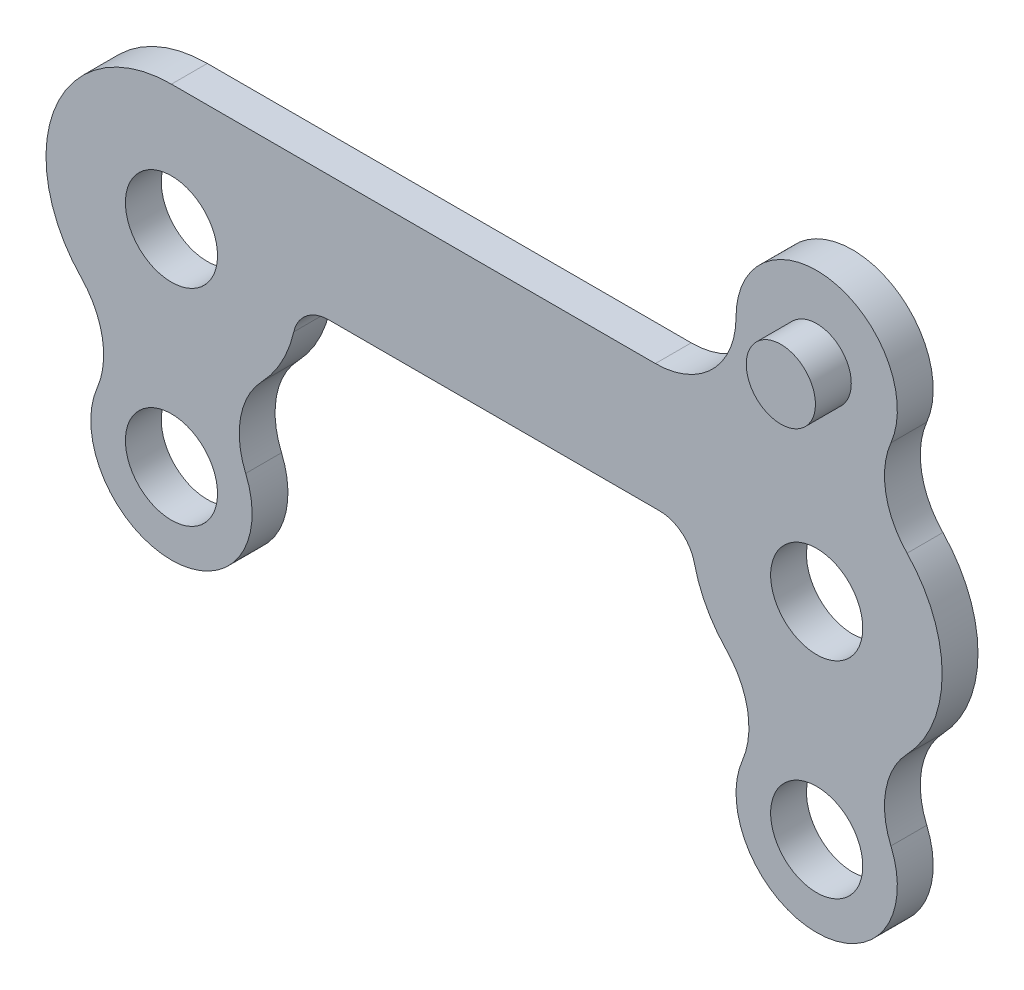
from build123d import *

# Parameters (mm, degrees)
SKETCH2_R           = 2.0399375
SKETCH2_R_2         = 1.5319375
BOSS_EXTRUDE1_DEPTH = 1.5875
SKETCH2_4_R         = 1.5319375
BOSS_EXTRUDE3_DEPTH = 3.175
FILLET1_R           = 1.5875


with BuildPart() as part:
    # Sketch2 → Boss-Extrude1 (new body)
    with BuildSketch(Plane.XY):
        with BuildLine():
            Line((21.43125, 5.55625), (0, 5.55625))
            ThreePointArc((0, 5.55625), (-5.113202022, 2.174184709), (-4.001636229, -3.854714199))
            ThreePointArc((-4.001636229, -3.854714199), (-3.061446645, -5.685103398), (-3.287058415, -7.730434766))
            ThreePointArc((-3.287058415, -7.730434766), (0, -12.7), (3.287058415, -7.730434766))
            ThreePointArc((3.287058415, -7.730434766), (3.061446641, -5.685103418), (4.0016362, -3.854714229))
            ThreePointArc((4.0016362, -3.854714229), (5.152960566, -2.078199091), (5.55625, 0))
            Line((5.55625, 0), (23.01875, 0))
            ThreePointArc((23.01875, 0), (23.422039385, -2.07819897), (24.573363619, -3.854714041))
            ThreePointArc((24.573363619, -3.854714041), (25.513553344, -5.685103337), (25.287941547, -7.730434854))
            ThreePointArc((25.287941547, -7.730434854), (28.575000048, -12.7), (31.862058415, -7.730434766))
            ThreePointArc((31.862058415, -7.730434766), (31.636446655, -5.685103342), (32.576636308, -3.854714117))
            ThreePointArc((32.576636308, -3.854714117), (34.13125, -7.3e-08), (32.576636409, 3.854714012))
            ThreePointArc((32.576636409, 3.854714012), (31.636446674, 5.685103241), (31.862058392, 7.730434711))
            ThreePointArc((31.862058392, 7.730434711), (29.288207306, 12.628071622), (25.003125, 9.128125))
            ThreePointArc((25.003125, 9.128125), (23.956947034, 6.602427966), (21.43125, 5.55625))
        make_face()
        Circle(SKETCH2_R, mode=Mode.SUBTRACT)
        with Locations((28.575, 0)):
            Circle(SKETCH2_R, mode=Mode.SUBTRACT)
        with Locations((28.575, 9.128125)):
            Circle(SKETCH2_R_2, mode=Mode.SUBTRACT)
        with Locations((0, -9.128125)):
            Circle(SKETCH2_R, mode=Mode.SUBTRACT)
        with Locations((28.575, -9.128125)):
            Circle(SKETCH2_R, mode=Mode.SUBTRACT)
    extrude(amount=BOSS_EXTRUDE1_DEPTH)

    # Sketch2<4> → Boss-Extrude3 (add)
    with BuildSketch(Plane.XY):
        with Locations((28.575, 9.128125)):
            Circle(SKETCH2_4_R)
    extrude(amount=BOSS_EXTRUDE3_DEPTH)

    # Fillet1
    fillet1_edges = [part.edges().sort_by_distance(p)[0] for p in [
        (23.01875, 0, 0.79375),
        (5.55625, 0, 0.79375),
    ]]
    fillet(fillet1_edges, radius=FILLET1_R)


solid = part.part
